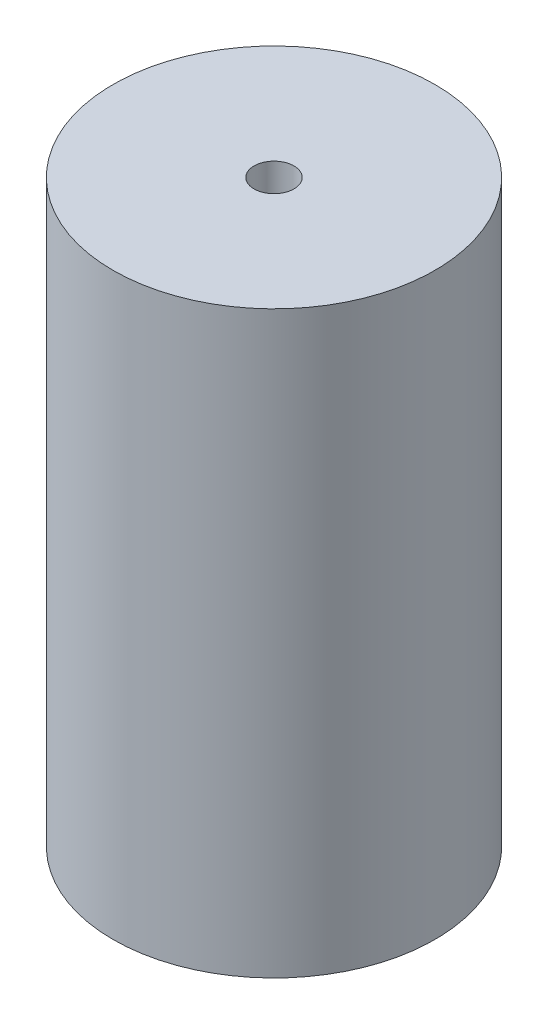
from build123d import *

# Parameters (mm, degrees)
SKETCH5_R           = 31.75
BOSS_EXTRUDE1_DEPTH = 114.3
SKETCH7_R           = 3.937
CUT_EXTRUDE1_DEPTH  = 88.9


with BuildPart() as part:
    # Sketch5 → Boss-Extrude1 (new body)
    with BuildSketch(Plane(origin=(0, 0, 0), x_dir=(1, 0, 0), z_dir=(0, 1, 0))):
        with Locations(Location((0, 0, 0), (0, 0, 270))):
            Circle(SKETCH5_R)
    extrude(amount=BOSS_EXTRUDE1_DEPTH)

    # Sketch7 → Cut-Extrude1 (cut)
    with BuildSketch(Plane(origin=(0, 114.3, 0), x_dir=(1, 0, 0), z_dir=(0, 1, 0))):
        with Locations(Location((0, 0, 0), (0, 0, 270))):
            Circle(SKETCH7_R)
    extrude(amount=-CUT_EXTRUDE1_DEPTH, mode=Mode.SUBTRACT)


solid = part.part
